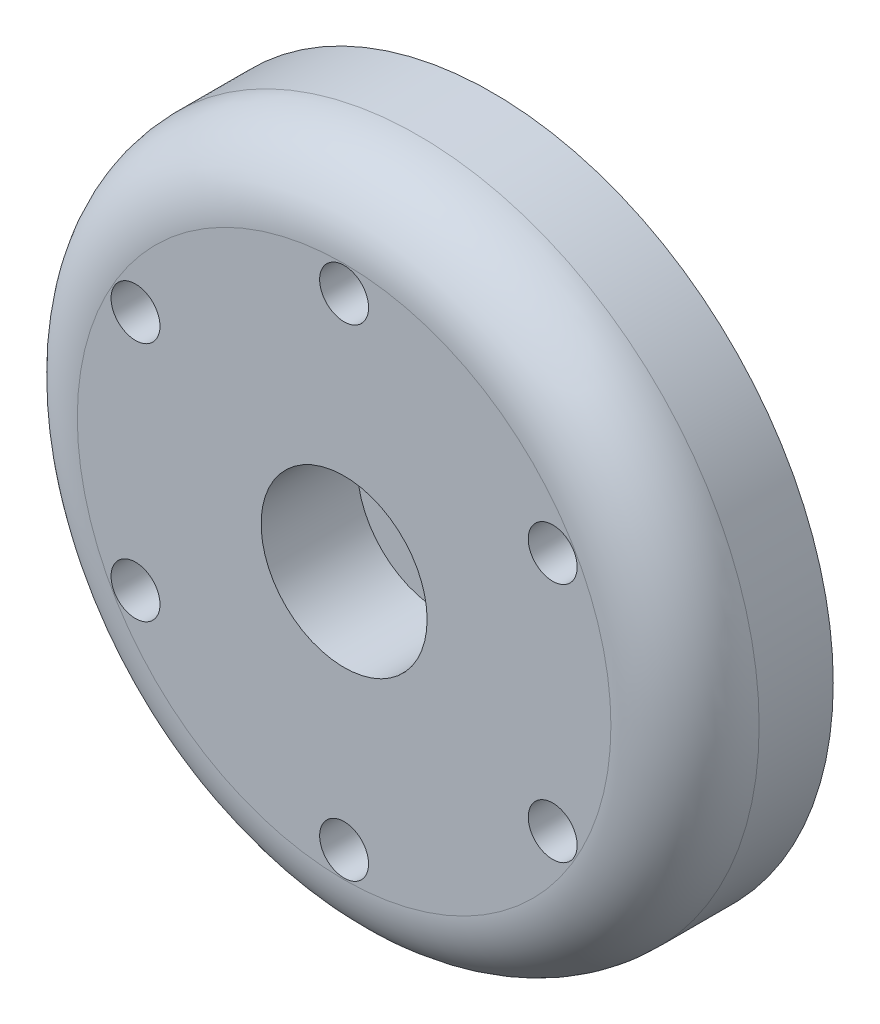
from build123d import *

# Parameters (mm, degrees)
SKETCH1_W                                           = 23
SKETCH1_H                                           = 10
HOLE1_D                                             = 40
HOLE1_DEPTH                                         = 5.8
SKETCH4_W                                           = 12.5
SKETCH4_H                                           = 5.8
F_4_CLEARANCE_HOLE1_D                               = 3.3
F_4_CLEARANCE_HOLE1_DEPTH                           = 10
CBORE_FOR_12_BINDING_HEAD_MACHINE_SCREW_D           = 6.045
CBORE_FOR_12_BINDING_HEAD_MACHINE_SCREW_CBORE_D     = 11.2
CBORE_FOR_12_BINDING_HEAD_MACHINE_SCREW_CBORE_DEPTH = 6.5
FILLET1_R                                           = 5


with BuildPart() as part:
    # Sketch1 → Revolve1 (revolve)
    with BuildSketch(Plane.XZ, mode=Mode.PRIVATE) as revolve1_sk:
        with Locations((11.5, 5)):
            Rectangle(SKETCH1_W, SKETCH1_H)
    revolve(revolve1_sk.sketch.rotate(Axis((0, 0, 10), (0, 0, -1)), 180), axis=Axis((0, 0, 10), (0, 0, -1)))

    # Hole1
    with Locations(Plane(origin=(0, 0, 0), x_dir=(-1, 0, 0), z_dir=(0, 0, -1))):
        with Locations((0, 0)):
            Hole(HOLE1_D / 2, depth=HOLE1_DEPTH)

    # Sketch4 → Revolve2 (revolve)
    with BuildSketch(Plane.XZ, mode=Mode.PRIVATE) as revolve2_sk:
        with Locations((6.25, 2.9)):
            Rectangle(SKETCH4_W, SKETCH4_H)
    revolve(revolve2_sk.sketch.rotate(Axis((0, 0, 5.8), (0, 0, -1)), 180), axis=Axis((0, 0, 5.8), (0, 0, -1)))

    # #4 Clearance Hole1
    with Locations(Plane.XY.offset(10)):
        with Locations((14.072912811, 8.125), (14.072912811, -8.125), (0, -16.25), (-14.072912811, -8.125), (-14.072912811, 8.125), (0, 16.25)):
            Hole(F_4_CLEARANCE_HOLE1_D / 2, depth=F_4_CLEARANCE_HOLE1_DEPTH)

    # CBORE for #12 Binding Head Machine Screw1 (through all)
    with Locations(Plane.XY.offset(10)):
        with Locations((0, 0)):
            CounterBoreHole(CBORE_FOR_12_BINDING_HEAD_MACHINE_SCREW_D / 2, CBORE_FOR_12_BINDING_HEAD_MACHINE_SCREW_CBORE_D / 2, CBORE_FOR_12_BINDING_HEAD_MACHINE_SCREW_CBORE_DEPTH)

    # Fillet1
    fillet1_edges = [part.edges().sort_by_distance(p)[0] for p in [
        (23, 0, 10),
    ]]
    fillet(fillet1_edges, radius=FILLET1_R)


solid = part.part
